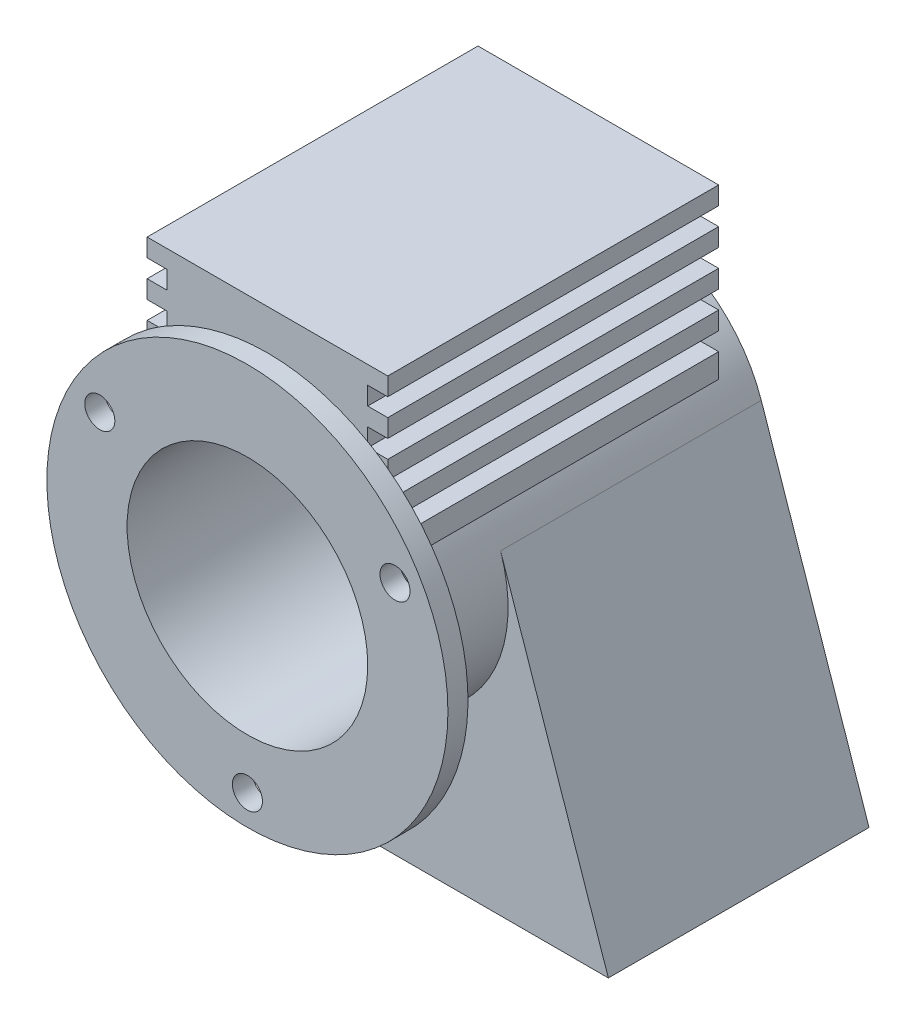
from build123d import *

# Parameters (mm, degrees)
BOSS_EXTRUDE1_DEPTH     = 3.25
BOSS_EXTRUDE2_START     = 2.5
SKETCH2_R               = 3.5
BOSS_EXTRUDE2_DEPTH     = 2.5
SKETCH3_R               = 5
BOSS_EXTRUDE3_DEPTH     = 0.5
BOSS_EXTRUDE4_DEPTH     = 8.25
SKETCH6_W               = 0.5
SKETCH6_H               = 0.45
CUT_EXTRUDE1_DEPTH      = 8.25
LPATTERN1_COUNT         = 4
LPATTERN1_PITCH         = 0.9
MIRROR1_COPY_1_SKETCH_W = 0.5
MIRROR1_COPY_1_SKETCH_H = 0.45
MIRROR1_COPY_1_DEPTH    = 8.25
MIRROR1_COPY_2_SKETCH_W = 0.5
MIRROR1_COPY_2_SKETCH_H = 0.45
MIRROR1_COPY_2_DEPTH    = 8.25
MIRROR1_COPY_3_SKETCH_W = 0.5
MIRROR1_COPY_3_SKETCH_H = 0.45
MIRROR1_COPY_3_DEPTH    = 8.25
MIRROR1_COPY_4_SKETCH_W = 0.5
MIRROR1_COPY_4_SKETCH_H = 0.45
MIRROR1_COPY_4_DEPTH    = 8.25
SKETCH7_R               = 3
CUT_EXTRUDE2_DEPTH      = 9
SKETCH7_4_R             = 0.75
CUT_EXTRUDE3_DEPTH      = 14.107726729
CUT_EXTRUDE4_REACH      = 15.108
SKETCH7_5_R             = 0.375


with BuildPart() as part:
    # Sketch1 → Boss-Extrude1 (new, symmetric)
    with BuildSketch(Plane.XY):
        with BuildLine():
            Line((-6, -6.75), (6, -6.75))
            Line((6, -6.75), (3.312648335, 1.129761483))
            ThreePointArc((3.312648335, 1.129761483), (0, 3.5), (-3.312648335, 1.129761483))
            Line((-3.312648335, 1.129761483), (-6, -6.75))
        make_face()
    extrude(amount=BOSS_EXTRUDE1_DEPTH, both=True)

    # Sketch2 → Boss-Extrude2 (add)
    with BuildSketch(Plane.XY.offset(3.25).offset(BOSS_EXTRUDE2_START)):
        Circle(SKETCH2_R)
    extrude(amount=-BOSS_EXTRUDE2_DEPTH)

    # Sketch3 → Boss-Extrude3 (add)
    with BuildSketch(Plane.XY.offset(5.75)):
        Circle(SKETCH3_R)
    extrude(amount=BOSS_EXTRUDE3_DEPTH)

    # Sketch5 → Boss-Extrude4 (add)
    with BuildSketch(Plane(origin=(0, 0, 5.75), x_dir=(-1, 0, 0), z_dir=(0, 0, -1))):
        with BuildLine():
            ThreePointArc((-3, 1.802775638), (0, 3.5), (3, 1.802775638))
            Line((3, 1.802775638), (3, 6))
            Line((3, 6), (-3, 6))
            Line((-3, 6), (-3, 1.802775638))
        make_face()
    extrude(amount=BOSS_EXTRUDE4_DEPTH)

    # Sketch6 → Cut-Extrude1 (cut)
    with BuildSketch(Plane(origin=(0, 0, -2.5), x_dir=(-1, 0, 0), z_dir=(0, 0, -1))):
        with Locations((-2.75, 5.325)):
            Rectangle(SKETCH6_W, SKETCH6_H)
    cut_extrude1 = extrude(amount=-CUT_EXTRUDE1_DEPTH, mode=Mode.SUBTRACT)

    # LPattern1: Cut-Extrude1 ×4
    with Locations(*[(0, -i * LPATTERN1_PITCH, 0) for i in range(1, LPATTERN1_COUNT)]):
        add(cut_extrude1, mode=Mode.SUBTRACT)

    # Mirror1 copy 1 sketch → Mirror1 copy 1 (cut)
    with BuildSketch(Plane(origin=(0, -0.9, -2.5), x_dir=(1, 0, 0), z_dir=(0, 0, -1))):
        with Locations((-2.75, -5.325)):
            Rectangle(MIRROR1_COPY_1_SKETCH_W, MIRROR1_COPY_1_SKETCH_H)
    extrude(amount=-MIRROR1_COPY_1_DEPTH, mode=Mode.SUBTRACT)

    # Mirror1 copy 2 sketch → Mirror1 copy 2 (cut)
    with BuildSketch(Plane(origin=(0, -1.8, -2.5), x_dir=(1, 0, 0), z_dir=(0, 0, -1))):
        with Locations((-2.75, -5.325)):
            Rectangle(MIRROR1_COPY_2_SKETCH_W, MIRROR1_COPY_2_SKETCH_H)
    extrude(amount=-MIRROR1_COPY_2_DEPTH, mode=Mode.SUBTRACT)

    # Mirror1 copy 3 sketch → Mirror1 copy 3 (cut)
    with BuildSketch(Plane(origin=(0, -2.7, -2.5), x_dir=(1, 0, 0), z_dir=(0, 0, -1))):
        with Locations((-2.75, -5.325)):
            Rectangle(MIRROR1_COPY_3_SKETCH_W, MIRROR1_COPY_3_SKETCH_H)
    extrude(amount=-MIRROR1_COPY_3_DEPTH, mode=Mode.SUBTRACT)

    # Mirror1 copy 4 sketch → Mirror1 copy 4 (cut)
    with BuildSketch(Plane(origin=(0, 0, -2.5), x_dir=(1, 0, 0), z_dir=(0, 0, -1))):
        with Locations((-2.75, -5.325)):
            Rectangle(MIRROR1_COPY_4_SKETCH_W, MIRROR1_COPY_4_SKETCH_H)
    extrude(amount=-MIRROR1_COPY_4_DEPTH, mode=Mode.SUBTRACT)

    # Sketch7 → Cut-Extrude2 (cut)
    with BuildSketch(Plane.XY.offset(6.25)):
        Circle(SKETCH7_R)
    extrude(amount=-CUT_EXTRUDE2_DEPTH, mode=Mode.SUBTRACT)

    # Sketch7<4> → Cut-Extrude3 (cut, through all)
    with BuildSketch(Plane.XY.offset(6.25)):
        Circle(SKETCH7_4_R)
    extrude(amount=-CUT_EXTRUDE3_DEPTH, mode=Mode.SUBTRACT)

    # Sketch7<5> → Cut-Extrude4 (cut, up to next)
    with BuildSketch(Plane.XY.offset(6.25), mode=Mode.PRIVATE) as cut_extrude4_sk1:
        with Locations((0, -4.25)):
            Circle(SKETCH7_5_R)
    cut_extrude4_tool1 = extrude(cut_extrude4_sk1.sketch, amount=-CUT_EXTRUDE4_REACH, mode=Mode.PRIVATE) & part.part
    # Sketch7<5> → Cut-Extrude4 (cut, up to next)
    with BuildSketch(Plane.XY.offset(6.25), mode=Mode.PRIVATE) as cut_extrude4_sk2:
        with Locations((-3.680607966, 2.125)):
            Circle(SKETCH7_5_R)
    cut_extrude4_tool2 = extrude(cut_extrude4_sk2.sketch, amount=-CUT_EXTRUDE4_REACH, mode=Mode.PRIVATE) & part.part
    # Sketch7<5> → Cut-Extrude4 (cut, up to next)
    with BuildSketch(Plane.XY.offset(6.25), mode=Mode.PRIVATE) as cut_extrude4_sk3:
        with Locations((3.680607966, 2.125)):
            Circle(SKETCH7_5_R)
    cut_extrude4_tool3 = extrude(cut_extrude4_sk3.sketch, amount=-CUT_EXTRUDE4_REACH, mode=Mode.PRIVATE) & part.part
    add(cut_extrude4_tool1.solids().sort_by_distance((0, -4.25, 6.25))[0], mode=Mode.SUBTRACT)
    add(cut_extrude4_tool2.solids().sort_by_distance((-3.680608, 2.125, 6.25))[0], mode=Mode.SUBTRACT)
    add(cut_extrude4_tool3.solids().sort_by_distance((3.680608, 2.125, 6.25))[0], mode=Mode.SUBTRACT)


solid = part.part
